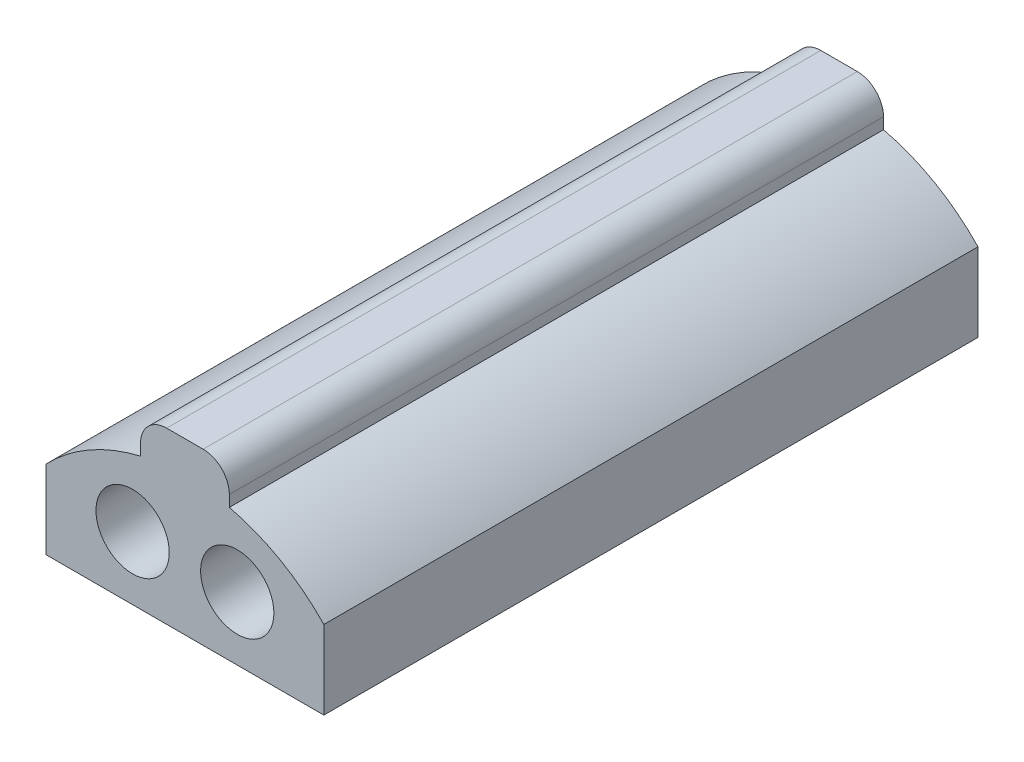
from build123d import *

# Parameters (mm, degrees)
BOSS_EXTRUDE1_DEPTH = 50
SKETCH2_R           = 2.8
CUT_EXTRUDE1_DEPTH  = 53.73966846


with BuildPart() as part:
    # Sketch1 → Boss-Extrude1 (new body)
    with BuildSketch(Plane.XY):
        with BuildLine():
            Line((-10.618380291, 0), (10.618380291, 0))
            Line((10.618380291, 0), (10.618380291, 6))
            ThreePointArc((10.618380291, 6), (7.305893165, 8.590308493), (3.395577503, 10.136820848))
            Line((3.395577503, 10.136820848), (3.395577503, 10.989327513))
            ThreePointArc((3.395577503, 10.989327513), (2.809791065, 12.403541075), (1.395577503, 12.989327513))
            Line((1.395577503, 12.989327513), (-1.395577503, 12.989327513))
            ThreePointArc((-1.395577503, 12.989327513), (-2.809791065, 12.403541075), (-3.395577503, 10.989327513))
            Line((-3.395577503, 10.989327513), (-3.395577503, 10.136820848))
            ThreePointArc((-3.395577503, 10.136820848), (-7.305893165, 8.590308493), (-10.618380291, 6))
            Line((-10.618380291, 6), (-10.618380291, 0))
        make_face()
    extrude(amount=-BOSS_EXTRUDE1_DEPTH)

    # Sketch2 → Cut-Extrude1 (cut, through all)
    with BuildSketch(Plane.XY):
        with Locations((-4, 4.84)):
            Circle(SKETCH2_R)
        with Locations((4, 4.84)):
            Circle(SKETCH2_R)
    extrude(amount=-CUT_EXTRUDE1_DEPTH, mode=Mode.SUBTRACT)


solid = part.part
